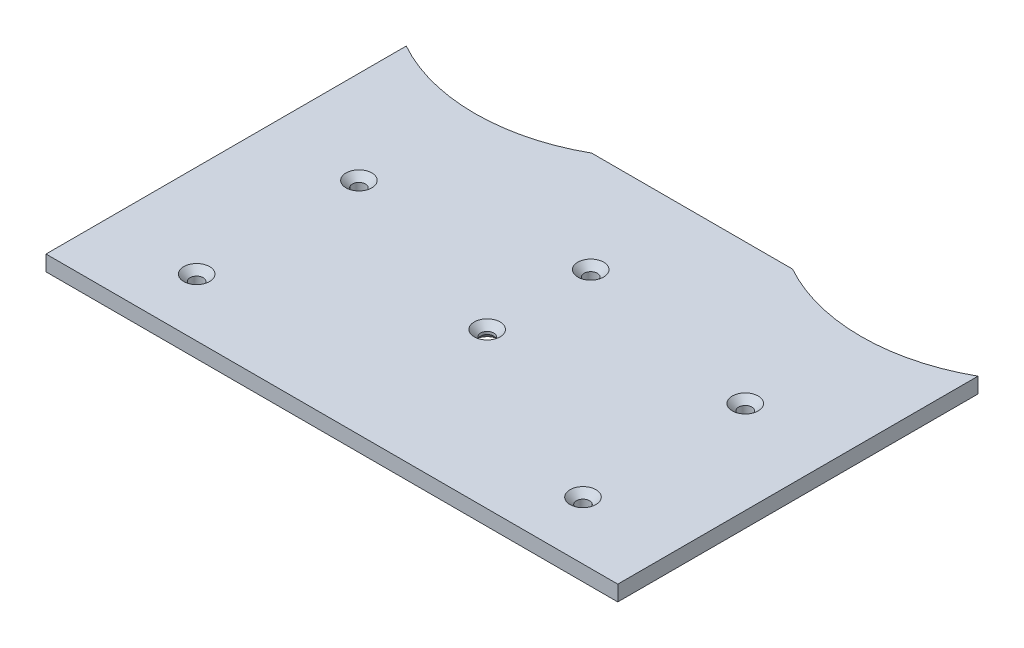
from build123d import *

# Parameters (mm, degrees)
BOSS_EXTRUDE1_DEPTH = 4
SKETCH4_R           = 1.7
CUT_EXTRUDE1_DEPTH  = 4
CHAMFER1_SIZE       = 1.65


with BuildPart() as part:
    # Sketch1 → Boss-Extrude1 (new body)
    with BuildSketch(Plane(origin=(0, 0, 0), x_dir=(1, 0, 0), z_dir=(0, 1, 0))):
        with BuildLine():
            Line((-74, 43.5), (-74, 49.7434598))
            ThreePointArc((-74, 49.7434598), (-50, 43.5), (-26, 49.7434598))
            Line((-26, 49.7434598), (26, 49.7434598))
            ThreePointArc((26, 49.7434598), (50, 43.5), (74, 49.7434598))
            Line((74, 49.7434598), (74, 43.5))
            Line((74, 43.5), (74, -43.5))
            Line((74, -43.5), (-74, -43.5))
            Line((-74, -43.5), (-74, 43.5))
        make_face()
    extrude(amount=BOSS_EXTRUDE1_DEPTH)

    # Sketch4 → Cut-Extrude1 (cut)
    with BuildSketch(Plane(origin=(0, 4, 0), x_dir=(1, 0, 0), z_dir=(0, 1, 0))):
        with Locations(Location((-50, -28.5, 0), (0, 0, 270))):
            Circle(SKETCH4_R)
        with Locations(Location((-50, 13.5, 0), (0, 0, 270))):
            Circle(SKETCH4_R)
        with Locations(Location((0, -3.3, 0), (0, 0, 270))):
            Circle(SKETCH4_R)
        with Locations(Location((0, 23.5, 0), (0, 0, 270))):
            Circle(SKETCH4_R)
        with Locations(Location((50, -28.5, 0), (0, 0, 270))):
            Circle(SKETCH4_R)
        with Locations(Location((50, 13.5, 0), (0, 0, 270))):
            Circle(SKETCH4_R)
    extrude(amount=-CUT_EXTRUDE1_DEPTH, mode=Mode.SUBTRACT)

    # Chamfer1
    chamfer1_edges = [part.edges().sort_by_distance(p)[0] for p in [
        (50, 4, 26.8),
        (0, 4, -25.2),
        (0, 4, 1.6),
        (0, 0, 1.6),
        (-50, 4, -15.2),
        (50, 4, -15.2),
        (-50, 4, 26.8),
    ]]
    chamfer(chamfer1_edges, length=CHAMFER1_SIZE)


solid = part.part
